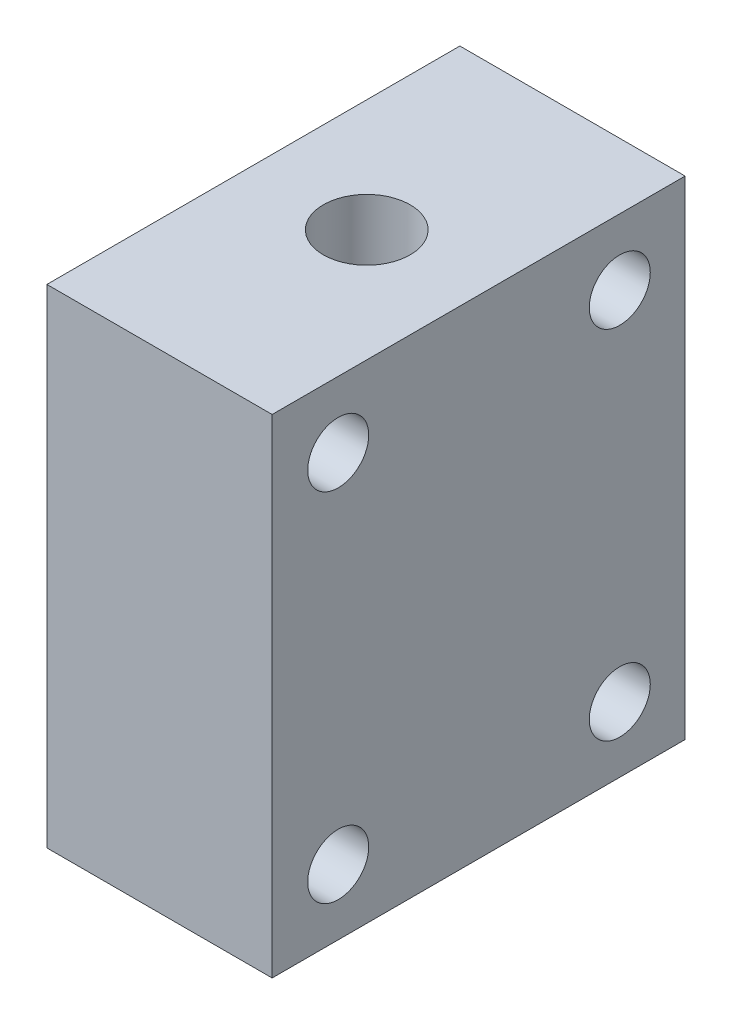
from build123d import *

# Parameters (mm, degrees)
SKETCH1_W           = 82.55
SKETCH1_H           = 69.85
BOSS_EXTRUDE1_DEPTH = 38.1
SKETCH2_R           = 5.159375
CUT_EXTRUDE2_DEPTH  = 115.652235041
SKETCH3_R           = 5.159375
CUT_EXTRUDE4_DEPTH  = 115.652235041
SKETCH4_R           = 7.3421875
CUT_EXTRUDE6_DEPTH  = 28.448
SKETCH5_R           = 12.7254
CUT_EXTRUDE8_DEPTH  = 2.8194
SKETCH6_R           = 7.3421875
CUT_EXTRUDE10_DEPTH = 28.448
SKETCH7_R           = 12.7254
CUT_EXTRUDE12_DEPTH = 2.8194
CUT_EXTRUDE14_START = 82.55
SKETCH8_R           = 7.3421875
CUT_EXTRUDE14_DEPTH = 60.452


with BuildPart() as part:
    # Sketch1 → Boss-Extrude1 (new body)
    with BuildSketch(Plane.YZ):
        with Locations((41.275, 34.925)):
            Rectangle(SKETCH1_W, SKETCH1_H)
    extrude(amount=BOSS_EXTRUDE1_DEPTH)

    # Sketch2 → Cut-Extrude2 (cut, through all)
    with BuildSketch(Plane.YZ):
        with Locations(Location((11.049, 11.049, 0), (0, 0, 270))):
            Circle(SKETCH2_R)
    extrude(amount=CUT_EXTRUDE2_DEPTH, mode=Mode.SUBTRACT)

    # Sketch3 → Cut-Extrude4 (cut, through all)
    with BuildSketch(Plane.YZ):
        with Locations(Location((71.374, 11.049, 0), (0, 0, 270))):
            Circle(SKETCH3_R)
        with Locations(Location((11.049, 58.674, 0), (0, 0, 270))):
            Circle(SKETCH3_R)
        with Locations(Location((71.374, 58.674, 0), (0, 0, 270))):
            Circle(SKETCH3_R)
    extrude(amount=CUT_EXTRUDE4_DEPTH, mode=Mode.SUBTRACT)

    # Sketch4 → Cut-Extrude6 (cut)
    with BuildSketch(Plane.YZ):
        with Locations(Location((23.622, 34.798, 0), (0, 0, 270))):
            Circle(SKETCH4_R)
    extrude(amount=CUT_EXTRUDE6_DEPTH, mode=Mode.SUBTRACT)

    # Sketch5 → Cut-Extrude8 (cut)
    with BuildSketch(Plane.YZ):
        with Locations(Location((23.622, 34.798, 0), (0, 0, 270))):
            Circle(SKETCH5_R)
    extrude(amount=CUT_EXTRUDE8_DEPTH, mode=Mode.SUBTRACT)

    # Sketch6 → Cut-Extrude10 (cut)
    with BuildSketch(Plane.YZ):
        with Locations(Location((58.674, 34.798, 0), (0, 0, 270))):
            Circle(SKETCH6_R)
    extrude(amount=CUT_EXTRUDE10_DEPTH, mode=Mode.SUBTRACT)

    # Sketch7 → Cut-Extrude12 (cut)
    with BuildSketch(Plane.YZ):
        with Locations(Location((58.674, 34.798, 0), (0, 0, 270))):
            Circle(SKETCH7_R)
    extrude(amount=CUT_EXTRUDE12_DEPTH, mode=Mode.SUBTRACT)

    # Sketch8 → Cut-Extrude14 (cut)
    with BuildSketch(Plane(origin=(0, 0, 0), x_dir=(-1, 0, 0), z_dir=(0, 1, 0)).offset(CUT_EXTRUDE14_START)):
        with Locations(Location((-19.05, 34.798, 0), (0, 0, 90))):
            Circle(SKETCH8_R)
    extrude(amount=-CUT_EXTRUDE14_DEPTH, mode=Mode.SUBTRACT)


solid = part.part
